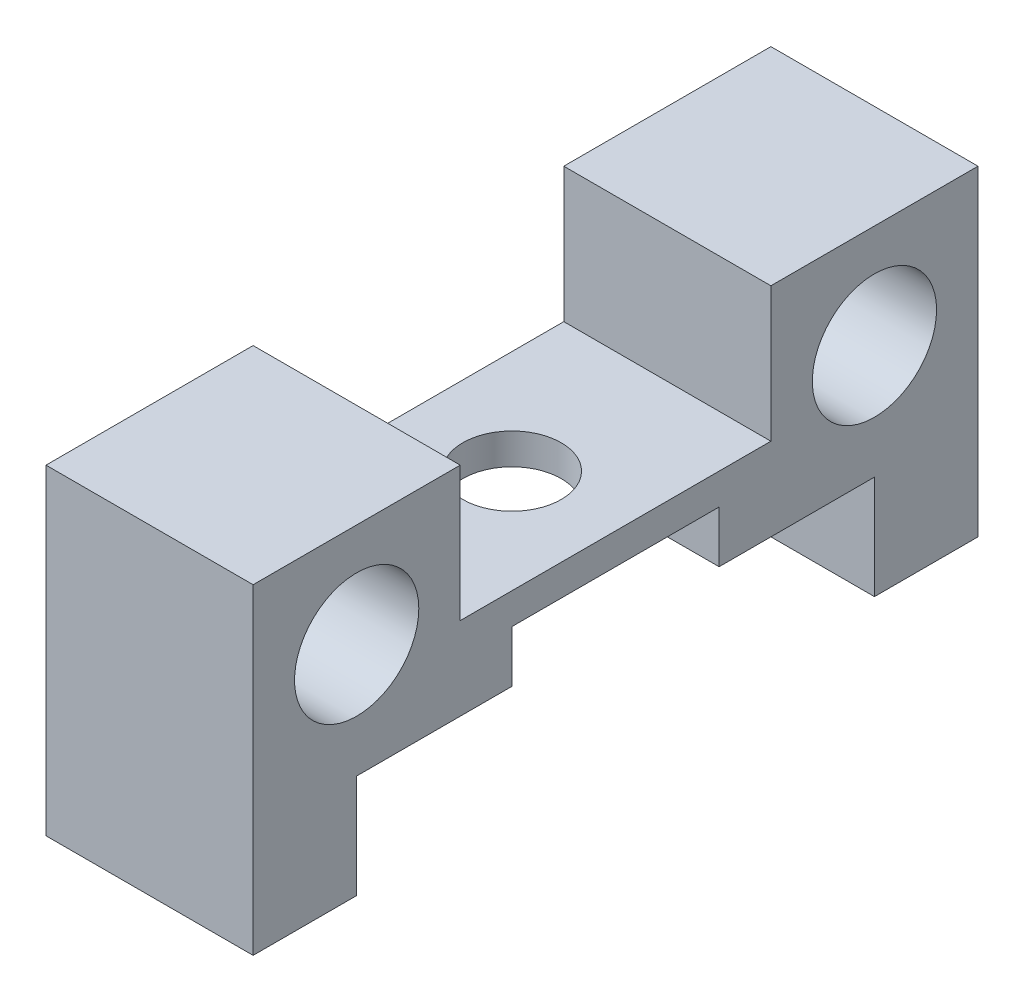
from build123d import *

# Parameters (mm, degrees)
ESQUISSE1_W             = 20
ESQUISSE1_H             = 31
EXTRUSION1_DEPTH        = 70
ESQUISSE2_W             = 30
ESQUISSE2_H             = 13
EXTRUSION2_DEPTH        = 80.126481029
ESQUISSE3_R             = 4.75
EXTRUSION3_DEPTH        = 75.993333037
ESQUISSE4_R             = 6
EXTRUSION4_DEPTH        = 80.126481029
ESQUISSE5_R             = 1.5
ENL_V_MAT_EXTRU_1_DEPTH = 10


with BuildPart() as part:
    # Esquisse1 → Extrusion1 (new body)
    with BuildSketch(Plane.XY):
        with Locations((10, 15.5)):
            Rectangle(ESQUISSE1_W, ESQUISSE1_H)
    extrude(amount=EXTRUSION1_DEPTH)

    # Esquisse2 → Extrusion2 (cut, through all)
    with BuildSketch(Plane(origin=(20, 0, 0), x_dir=(0, 0, -1), z_dir=(1, 0, 0))):
        with Locations((-35, 24.5)):
            Rectangle(ESQUISSE2_W, ESQUISSE2_H)
        Polygon((-45, 10), (-60, 10), (-60, 0), (-10, 0), (-10, 10), (-25, 10), (-25, 15), (-45, 15), align=None)
    extrude(amount=-EXTRUSION2_DEPTH, mode=Mode.SUBTRACT)

    # Esquisse3 → Extrusion3 (cut, through all)
    with BuildSketch(Plane(origin=(0, 18, 0), x_dir=(1, 0, 0), z_dir=(0, 1, 0))):
        with Locations(Location((10, -35, 0), (0, 0, 270))):
            Circle(ESQUISSE3_R)
    extrude(amount=-EXTRUSION3_DEPTH, mode=Mode.SUBTRACT)

    # Esquisse4 → Extrusion4 (cut, through all)
    with BuildSketch(Plane(origin=(20, 0, 0), x_dir=(0, 0, -1), z_dir=(1, 0, 0))):
        with Locations((-60, 21)):
            Circle(ESQUISSE4_R)
        with Locations((-10, 21)):
            Circle(ESQUISSE4_R)
    extrude(amount=-EXTRUSION4_DEPTH, mode=Mode.SUBTRACT)

    # Esquisse5 → Enlèv. mat.-Extru.1 (cut)
    with BuildSketch(Plane.XZ):
        with Locations(Location((5, 65, 0), (0, 0, 270))):
            Circle(ESQUISSE5_R)
        with Locations(Location((5, 5, 0), (0, 0, 270))):
            Circle(ESQUISSE5_R)
        with Locations(Location((15, 65, 0), (0, 0, 270))):
            Circle(ESQUISSE5_R)
        with Locations(Location((15, 5, 0), (0, 0, 270))):
            Circle(ESQUISSE5_R)
    extrude(amount=-ENL_V_MAT_EXTRU_1_DEPTH, mode=Mode.SUBTRACT)


solid = part.part
